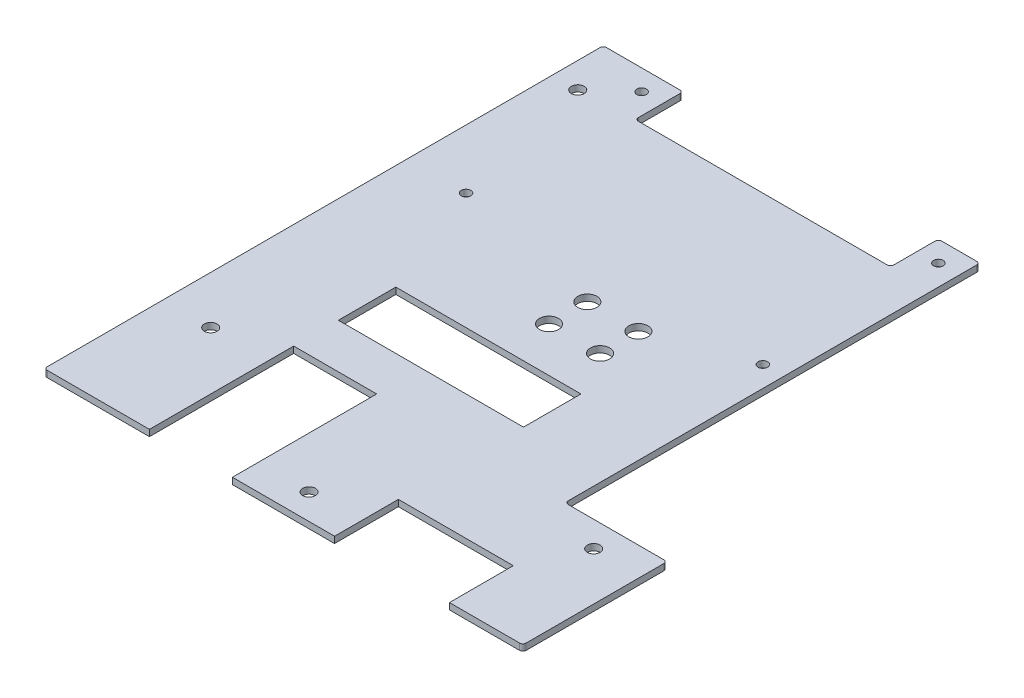
from build123d import *

# Parameters (mm, degrees)
CROQUIS1_W         = 150
CROQUIS1_H         = 175.2
CROQUIS1_R         = 1.5
EXTRUIR1_DEPTH     = 2
CROQUIS2_W         = 80
CROQUIS2_H         = 15
EXTRUIR2_DEPTH     = 10
CROQUIS3_W         = 32
CROQUIS3_H         = 130
EXTRUIR3_DEPTH     = 10
CROQUIS4_R         = 2
EXTRUIR4_DEPTH     = 10
CROQUIS5_R         = 3
EXTRUIR5_DEPTH     = 10
MATRIZL1_COUNT     = 2
MATRIZL1_PITCH     = 8
MATRIZL1_COL_COUNT = 2
MATRIZL1_COL_PITCH = 8
CROQUIS6_R         = 3
EXTRUIR6_DEPTH     = 2
CROQUIS7_W         = 26
CROQUIS7_H         = 45.2
CROQUIS7_W_2       = 36
CROQUIS7_H_2       = 20
CROQUIS7_W_3       = 58
CROQUIS7_H_3       = 18
EXTRUIR7_DEPTH     = 10
REDONDEO1_R        = 1


with BuildPart() as part:
    # Croquis1 → Extruir1 (new body)
    with BuildSketch(Plane(origin=(0, 0, 0), x_dir=(1, 0, 0), z_dir=(0, 1, 0))):
        Rectangle(CROQUIS1_W, CROQUIS1_H)
        with Locations(Location((-56.5, 81.1, 0), (0, 0, 270))):
            Circle(CROQUIS1_R, mode=Mode.SUBTRACT)
        with Locations(Location((36.5, 81.1, 0), (0, 0, 270))):
            Circle(CROQUIS1_R, mode=Mode.SUBTRACT)
        with Locations(Location((-56.5, 26.1, 0), (0, 0, 270))):
            Circle(CROQUIS1_R, mode=Mode.SUBTRACT)
        with Locations(Location((36.5, 26.1, 0), (0, 0, 270))):
            Circle(CROQUIS1_R, mode=Mode.SUBTRACT)
    extrude(amount=EXTRUIR1_DEPTH)

    # Croquis2 → Extruir2 (cut)
    with BuildSketch(Plane(origin=(0, 2, 0), x_dir=(1, 0, 0), z_dir=(0, 1, 0))):
        with Locations((-10, 80.1)):
            Rectangle(CROQUIS2_W, CROQUIS2_H)
    extrude(amount=-EXTRUIR2_DEPTH, mode=Mode.SUBTRACT)

    # Croquis3 → Extruir3 (cut)
    with BuildSketch(Plane(origin=(0, 2, 0), x_dir=(1, 0, 0), z_dir=(0, 1, 0))):
        with Locations((59, 22.6)):
            Rectangle(CROQUIS3_W, CROQUIS3_H)
    extrude(amount=-EXTRUIR3_DEPTH, mode=Mode.SUBTRACT)

    # Croquis4 → Extruir4 (cut)
    with BuildSketch(Plane(origin=(0, 2, 0), x_dir=(1, 0, 0), z_dir=(0, 1, 0))):
        with Locations(Location((-60, -50.4, 0), (0, 0, 270))):
            Circle(CROQUIS4_R)
        with Locations(Location((60, -50.4, 0), (0, 0, 270))):
            Circle(CROQUIS4_R)
        with Locations(Location((-67, 71.6, 0), (0, 0, 270))):
            Circle(CROQUIS4_R)
        with Locations(Location((0, -79.6, 0), (0, 0, 270))):
            Circle(CROQUIS4_R)
    extrude(amount=-EXTRUIR4_DEPTH, mode=Mode.SUBTRACT)

    # Croquis5 → Extruir5 (cut)
    with BuildSketch(Plane(origin=(0, 2, 0), x_dir=(1, 0, 0), z_dir=(0, 1, 0))):
        with Locations(Location((0, 15.6, 0), (0, 0, 270))):
            Circle(CROQUIS5_R)
        with Locations(Location((0, 3.6, 0), (0, 0, 270))):
            Circle(CROQUIS5_R)
    extruir5 = extrude(amount=-EXTRUIR5_DEPTH, mode=Mode.SUBTRACT)

    # MatrizL1: Extruir5 ×2
    with Locations(*[(-i * MATRIZL1_PITCH, 0, 0) for i in range(1, MATRIZL1_COUNT)]):
        add(extruir5, mode=Mode.SUBTRACT)

    # MatrizL1 col: Extruir5 ×2
    with Locations(*[(i * MATRIZL1_COL_PITCH, 0, 0) for i in range(1, MATRIZL1_COL_COUNT)]):
        add(extruir5, mode=Mode.SUBTRACT)

    # Croquis6 → Extruir6 (add)
    with BuildSketch(Plane(origin=(0, 2, 0), x_dir=(1, 0, 0), z_dir=(0, 1, 0))):
        with Locations((0, 15.6)):
            Circle(CROQUIS6_R)
        with Locations((0, 3.6)):
            Circle(CROQUIS6_R)
    extrude(amount=-EXTRUIR6_DEPTH)

    # Croquis7 → Extruir7 (cut)
    with BuildSketch(Plane(origin=(0, 2, 0), x_dir=(1, 0, 0), z_dir=(0, 1, 0))):
        with Locations((-29, -65)):
            Rectangle(CROQUIS7_W, CROQUIS7_H)
        with Locations((34, -77.6)):
            Rectangle(CROQUIS7_W_2, CROQUIS7_H_2)
        with Locations((-13, -19.4)):
            Rectangle(CROQUIS7_W_3, CROQUIS7_H_3)
    extrude(amount=-EXTRUIR7_DEPTH, mode=Mode.SUBTRACT)

    # Redondeo1
    redondeo1_edges = [part.edges().sort_by_distance(p)[0] for p in [
        (30, 1, -87.6),
        (-50, 1, -87.6),
        (30, 1, -72.6),
        (-50, 1, -72.6),
        (43, 1, -87.6),
        (75, 1, 42.4),
        (43, 1, 42.4),
        (-75, 1, -87.6),
        (75, 1, 87.6),
        (-75, 1, 87.6),
    ]]
    fillet(redondeo1_edges, radius=REDONDEO1_R)


solid = part.part
